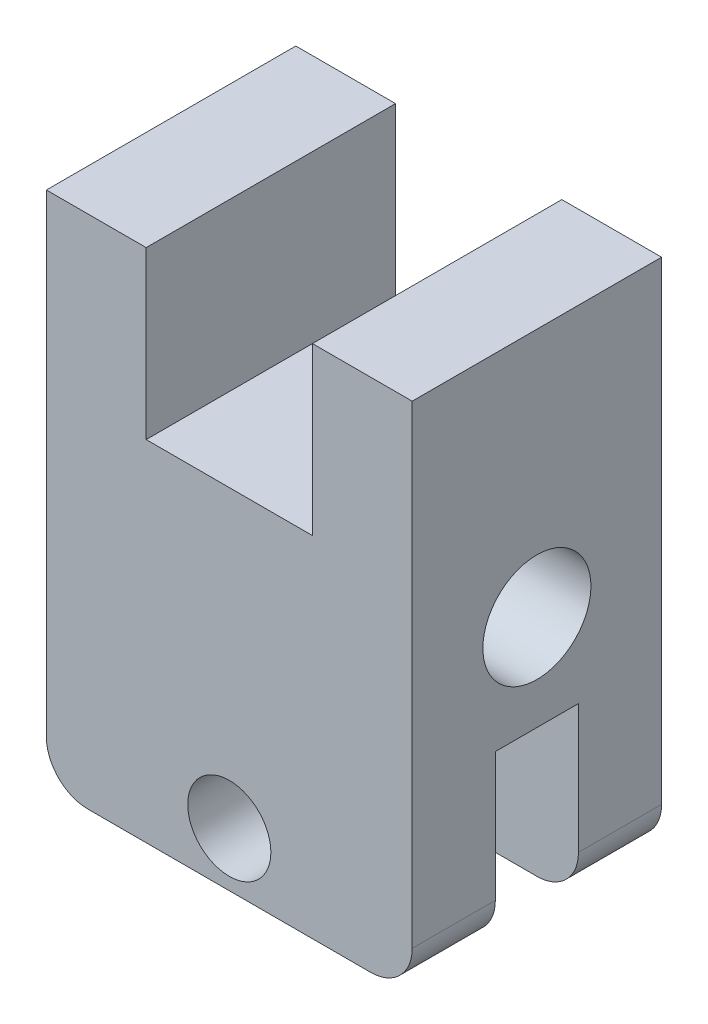
from build123d import *

# Parameters (mm, degrees)
CROQUIS1_R              = 5
BASE_DEPTH              = 30
CROQUIS4_R              = 7.5
CORTAR_EXTRUIR3_DEPTH   = 64.725975865
CROQUIS7_W              = 10
CROQUIS7_H              = 28.5
CORTAR_EXTRUIR6_DEPTH   = 64.725975865
CROQUIS8_W              = 44
CROQUIS8_H              = 8
CORTAR_EXTRUIR7_DEPTH   = 52.078371156
REDONDEO3_R             = 5
CROQUIS10_R             = 7.5
CROQUIS10_R_2           = 6.5
SALIENTE_EXTRUIR2_DEPTH = 10


with BuildPart() as part:
    # Croquis1 → Base (new body)
    with BuildSketch(Plane.XY):
        Polygon((-10, 35), (-22, 35), (-22, -35), (22, -35), (22, 35), (10, 35), (10, 15), (-10, 15), align=None)
        with Locations((0, -20.5)):
            Circle(CROQUIS1_R, mode=Mode.SUBTRACT)
    extrude(amount=BASE_DEPTH)

    # Croquis4 → Cortar-Extruir3 (cut, through all)
    with BuildSketch(Plane(origin=(22, 0, 0), x_dir=(0, 0, -1), z_dir=(1, 0, 0))):
        with Locations(Location((-15, 5, 0), (0, 0, 90))):
            Circle(CROQUIS4_R)
    extrude(amount=-CORTAR_EXTRUIR3_DEPTH, mode=Mode.SUBTRACT)

    # Croquis7 → Cortar-Extruir6 (cut, through all)
    with BuildSketch(Plane(origin=(22, 0, 0), x_dir=(0, 0, -1), z_dir=(1, 0, 0))):
        with Locations((-15, -20.75)):
            Rectangle(CROQUIS7_W, CROQUIS7_H)
    extrude(amount=-CORTAR_EXTRUIR6_DEPTH, mode=Mode.SUBTRACT)

    # Croquis8 → Cortar-Extruir7 (cut, through all)
    with BuildSketch(Plane.XY.offset(30)):
        with Locations((0, -31)):
            Rectangle(CROQUIS8_W, CROQUIS8_H)
    extrude(amount=-CORTAR_EXTRUIR7_DEPTH, mode=Mode.SUBTRACT)

    # Redondeo3
    redondeo3_edges = [part.edges().sort_by_distance(p)[0] for p in [
        (-22, -27, 25),
        (-22, -27, 5),
        (22, -27, 25),
        (22, -27, 5),
    ]]
    fillet(redondeo3_edges, radius=REDONDEO3_R)

    # Croquis10 → Saliente-Extruir2 (add)
    with BuildSketch(Plane(origin=(22, 0, 0), x_dir=(0, 0, -1), z_dir=(1, 0, 0))):
        with Locations(Location((-15, 5, 0), (0, 0, 90))):
            Circle(CROQUIS10_R)
        with Locations(Location((-15, 5, 0), (0, 0, 90))):
            Circle(CROQUIS10_R_2, mode=Mode.SUBTRACT)
    extrude(amount=-SALIENTE_EXTRUIR2_DEPTH)


solid = part.part
